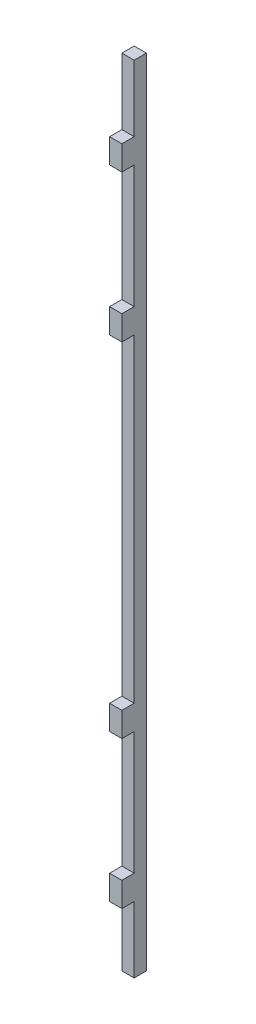
from build123d import *

# Parameters (mm, degrees)
SKETCH1_W           = 10
SKETCH1_H           = 5
BOSS_EXTRUDE1_DEPTH = 2.5


with BuildPart() as part:
    # Sketch1 → Boss-Extrude1 (new, symmetric)
    with BuildSketch(Plane.YZ):
        Polygon((75, 0), (65, 0), (0, 0), (0, -5), (162, -5), (162, 0), (135, 0), (125, 0), align=None)
        with Locations((70, 2.5)):
            Rectangle(SKETCH1_W, SKETCH1_H)
        with Locations((130, 2.5)):
            Rectangle(SKETCH1_W, SKETCH1_H)
    boss_extrude1 = extrude(amount=BOSS_EXTRUDE1_DEPTH, both=True)

    # Mirror1: Boss-Extrude1 across plane
    add(boss_extrude1.mirror(Plane.ZX))


solid = part.part
